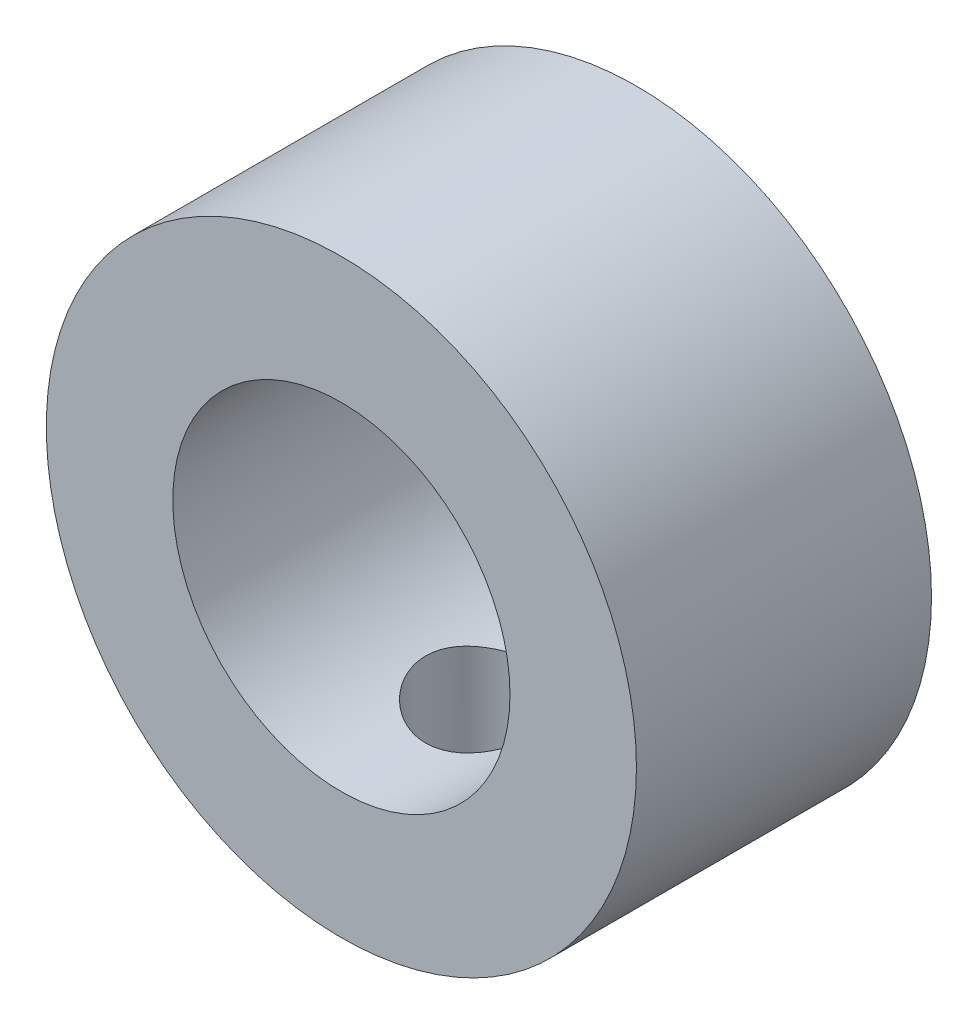
from build123d import *

# Parameters (mm, degrees)
SKETCH1_R               = 7
SKETCH1_R_2             = 4
BOSS_EXTRUDE1_DEPTH     = 7
CUT_EXTRUDE1_REACH      = 14.124
CUT_EXTRUDE1_END_RADIUS = 7
SKETCH2_R               = 1.5


with BuildPart() as part:
    # Sketch1 → Boss-Extrude1 (new body)
    with BuildSketch(Plane.XY):
        Circle(SKETCH1_R)
        Circle(SKETCH1_R_2, mode=Mode.SUBTRACT)
    extrude(amount=BOSS_EXTRUDE1_DEPTH)

    # Cut-Extrude1: up to this cylinder (the profile starts inside it)
    cut_extrude1_end = Plane(origin=(0, 0, 3.5), z_dir=(0, 0, -1)) * Cylinder(CUT_EXTRUDE1_END_RADIUS, 43.248, mode=Mode.PRIVATE)
    # Sketch2 → Cut-Extrude1 (cut, up to the surface)
    with BuildSketch(Plane(origin=(0, 0, 0), x_dir=(1, 0, 0), z_dir=(0, 1, 0)), mode=Mode.PRIVATE) as cut_extrude1_sk1:
        with Locations(Location((0, -3.5, 0), (0, 0, 270))):
            Circle(SKETCH2_R)
    cut_extrude1_tool1 = extrude(cut_extrude1_sk1.sketch, amount=-CUT_EXTRUDE1_REACH, mode=Mode.PRIVATE) & cut_extrude1_end
    add(cut_extrude1_tool1.solids().sort_by_distance((0, 0, 3.5))[0], mode=Mode.SUBTRACT)


solid = part.part
